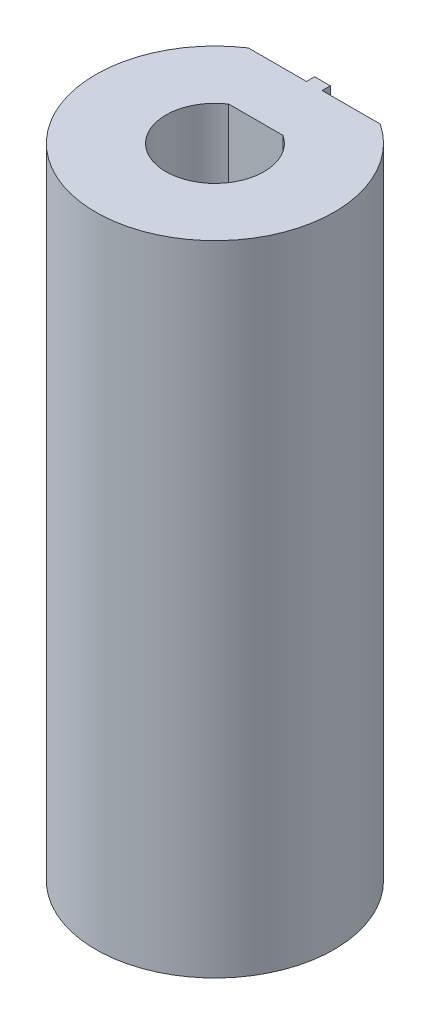
from build123d import *

# Parameters (mm, degrees)
EXTRUDE_1_DEPTH = 19.5


with BuildPart() as part:
    # 草图1 → 凸台-拉伸1 (new body)
    with BuildSketch(Plane(origin=(0, 0, 0), x_dir=(1, 0, 0), z_dir=(0, 1, 0))):
        with BuildLine():
            Line((-0.240061086, 3.033784066), (-2.012384688, 3.033784066))
            ThreePointArc((-2.012384688, 3.033784066), (0, -3.640540879), (2.012384688, 3.033784066))
            Line((2.012384688, 3.033784066), (0.240061086, 3.033784066))
            Line((0.240061086, 3.033784066), (0.240061086, 3.283784066))
            Line((0.240061086, 3.283784066), (-0.240061086, 3.283784066))
            Line((-0.240061086, 3.283784066), (-0.240061086, 3.033784066))
        make_face()
        with BuildLine():
            Line((-0.829156198, 1.25), (0.829156198, 1.25))
            ThreePointArc((0.829156198, 1.25), (0, -1.5), (-0.829156198, 1.25))
        make_face(mode=Mode.SUBTRACT)
    extrude(amount=EXTRUDE_1_DEPTH)


solid = part.part
